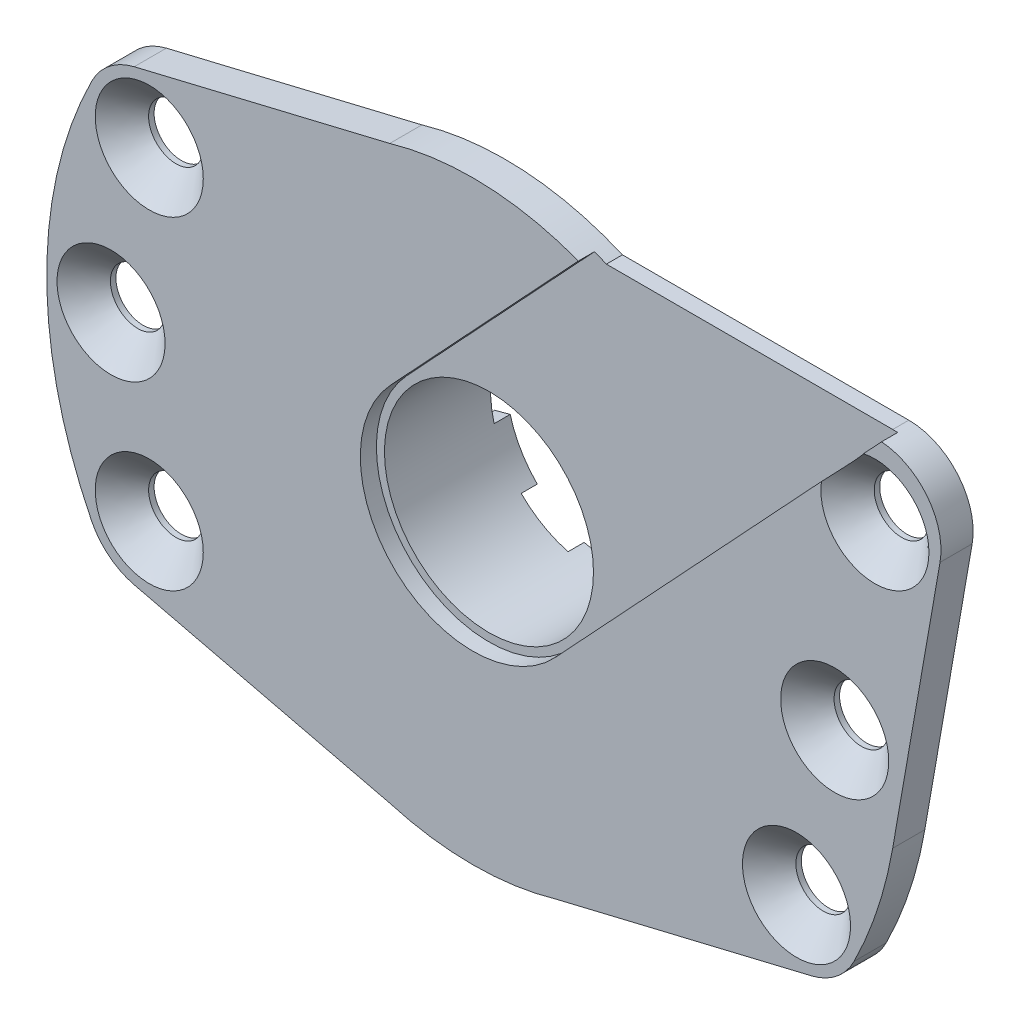
from build123d import *
from build123d.topology import SkipClean

# Parameters (mm, degrees)
SKETCH_1_R                 = 0.5
SKETCH_1_R_2               = 6.5
EXTRUDE_2_DEPTH            = 2
HOLE_WIZARD_M31_AT_2_COUNT = 2
HOLE_WIZARD_M31_AT_2_PITCH = 10.338881425
HOLE_WIZARD_M31_AT_3_COUNT = 2
HOLE_WIZARD_M31_AT_3_PITCH = 20.124611797
HOLE_WIZARD_M31_AT_4_COUNT = 2
HOLE_WIZARD_M31_AT_4_PITCH = 45
HOLE_WIZARD_M31_AT_5_COUNT = 2
HOLE_WIZARD_M31_AT_5_PITCH = 43.796204526
HOLE_WIZARD_M31_AT_6_COUNT = 2
HOLE_WIZARD_M31_AT_6_PITCH = 45.190407637
EXTRUDE_START              = 0.5
SKETCH_4_R                 = 8.5
SKETCH_4_R_2               = 6.5
EXTRUDE_3_DEPTH            = 0.5
EXTRUDE_START_2            = 5.1
SKETCH_5_R                 = 7.5
SKETCH_5_R_2               = 6.5
EXTRUDE_4_DEPTH            = 5.1
CUT_EXTRUDE_1_DEPTH        = 1
EXTRUDE_START_3            = 1
EXTRUDE_5_DEPTH            = 1


with BuildPart() as part:
    # Эскиз1 → Бобышка-Вытянуть2 (new body)
    with BuildSketch(Plane.XY):
        with BuildLine():
            Line((-5.16821295, 17.764543293), (-21.057898637, 13.951904294))
            ThreePointArc((-21.057898637, 13.951904294), (-22.612693727, 13.19430978), (-23.702320561, 11.851160281))
            ThreePointArc((-23.702320561, 11.851160281), (-26.5, 0), (-23.702320561, -11.851160281))
            ThreePointArc((-23.702320561, -11.851160281), (-22.612693727, -13.19430978), (-21.057898637, -13.951904294))
            Line((-21.057898637, -13.951904294), (-5.16821295, -17.764543293))
            ThreePointArc((-5.16821295, -17.764543293), (0, -18.50106547), (5.16821295, -17.764543293))
            Line((5.16821295, -17.764543293), (21.057898637, -13.951904294))
            ThreePointArc((21.057898637, -13.951904294), (22.612693727, -13.19430978), (23.702320561, -11.851160281))
            ThreePointArc((23.702320561, -11.851160281), (25.169556704, -8.291164895), (26.105397143, -4.556121157))
            Line((26.105397143, -4.556121157), (29.049405058, 12.312283599))
            ThreePointArc((29.049405058, 12.312283599), (28.170900607, 15.573823459), (25.108967753, 17))
            Line((25.108967753, 17), (7.299960514, 17))
            ThreePointArc((7.299960514, 17), (1.132350887, 18.466380397), (-5.16821295, 17.764543293))
        make_face()
        with Locations((25, 12.5)):
            Circle(SKETCH_1_R, mode=Mode.SUBTRACT)
        with Locations((22.5, 0)):
            Circle(SKETCH_1_R, mode=Mode.SUBTRACT)
        with Locations((20.124611797, -10.062305899)):
            Circle(SKETCH_1_R, mode=Mode.SUBTRACT)
        with Locations(Location((-20.124611797, -10.062305899, 0), (0, 0, 180))):
            Circle(SKETCH_1_R, mode=Mode.SUBTRACT)
        with Locations(Location((-22.5, 0, 0), (0, 0, 180))):
            Circle(SKETCH_1_R, mode=Mode.SUBTRACT)
        with Locations((-20.124611797, 10.062305899)):
            Circle(SKETCH_1_R, mode=Mode.SUBTRACT)
        Circle(SKETCH_1_R_2, mode=Mode.SUBTRACT)
    extrude(amount=EXTRUDE_2_DEPTH)

    # Эскиз3 → Зенковка для винта с потайной головкой и внутренним шестигранником M31 (revolve, cut)
    with BuildSketch(Plane(origin=(-20.124611797, 10.062305899, 2), x_dir=(0, -1, 0), z_dir=(1, 0, 0))):
        Polygon((0, 0), (0, 2), (1.7, 2), (1.7, 1.66), (3.36, 0), align=None)
    hole_wizard_m31 = revolve(axis=Axis((-20.124611797, 10.062305899, 8.35), (0, 0, -1)), mode=Mode.SUBTRACT)

    # Зенковка для винта с потайной головкой и внутренним шестигранником M31 at 2: Зенковка для винта с потайной головкой и внутренним шестигранником M31 ×2
    with Locations(*[Vector(-0.2297529205473615, -0.9732489894677301, 0) * (i * HOLE_WIZARD_M31_AT_2_PITCH) for i in range(1, HOLE_WIZARD_M31_AT_2_COUNT)]):
        add(hole_wizard_m31, mode=Mode.SUBTRACT)

    # Зенковка для винта с потайной головкой и внутренним шестигранником M31 at 3: Зенковка для винта с потайной головкой и внутренним шестигранником M31 ×2
    with Locations(*[(0, -i * HOLE_WIZARD_M31_AT_3_PITCH, 0) for i in range(1, HOLE_WIZARD_M31_AT_3_COUNT)]):
        add(hole_wizard_m31, mode=Mode.SUBTRACT)

    # Зенковка для винта с потайной головкой и внутренним шестигранником M31 at 4: Зенковка для винта с потайной головкой и внутренним шестигранником M31 ×2
    with Locations(*[Vector(0.894427190999916, -0.4472135954999578, 0) * (i * HOLE_WIZARD_M31_AT_4_PITCH) for i in range(1, HOLE_WIZARD_M31_AT_4_COUNT)]):
        add(hole_wizard_m31, mode=Mode.SUBTRACT)

    # Зенковка для винта с потайной головкой и внутренним шестигранником M31 at 5: Зенковка для винта с потайной головкой и внутренним шестигранником M31 ×2
    with Locations(*[Vector(0.9732489894677302, -0.2297529205473611, 0) * (i * HOLE_WIZARD_M31_AT_5_PITCH) for i in range(1, HOLE_WIZARD_M31_AT_5_COUNT)]):
        add(hole_wizard_m31, mode=Mode.SUBTRACT)

    # Зенковка для винта с потайной головкой и внутренним шестигранником M31 at 6: Зенковка для винта с потайной головкой и внутренним шестигранником M31 ×2
    with Locations(*[Vector(0.9985440308456991, 0.0539427331753181, 0) * (i * HOLE_WIZARD_M31_AT_6_PITCH) for i in range(1, HOLE_WIZARD_M31_AT_6_COUNT)]):
        add(hole_wizard_m31, mode=Mode.SUBTRACT)

    # Эскиз4 → Бобышка-Вытянуть3 (add)
    with SkipClean():  # the faces are left unmerged after this step: merging them gives an invalid solid
        with BuildSketch(Plane(origin=(0, 0, 0), x_dir=(-1, 0, 0), z_dir=(0, 0, -1)).offset(EXTRUDE_START)):
            with Locations(Location((0, 0, 0), (0, 0, 180))):
                Circle(SKETCH_4_R)
            Circle(SKETCH_4_R_2, mode=Mode.SUBTRACT)
        extrude(amount=-EXTRUDE_3_DEPTH)

    # Эскиз5 → Бобышка-Вытянуть4 (add)
    with SkipClean():  # the faces are left unmerged after this step: merging them gives an invalid solid
        with BuildSketch(Plane(origin=(0, 0, -0.5), x_dir=(-1, 0, 0), z_dir=(0, 0, -1)).offset(EXTRUDE_START_2)):
            Circle(SKETCH_5_R)
            Circle(SKETCH_5_R_2, mode=Mode.SUBTRACT)
        extrude(amount=-EXTRUDE_4_DEPTH)

    # Эскиз6 → Вырез-Вытянуть1 (cut)
    with SkipClean():  # the faces are left unmerged after this step: merging them gives an invalid solid
        with BuildSketch(Plane.XY.offset(2)):
            with BuildLine():
                Line((-5.119475911, 4.77398852), (15.340474891, 26.714599569))
                Line((15.340474891, 26.714599569), (25.579426713, 17.166622528))
                Line((25.579426713, 17.166622528), (5.119475911, -4.77398852))
                ThreePointArc((5.119475911, -4.77398852), (-4.77398852, -5.119475911), (-5.119475911, 4.77398852))
            make_face()
        extrude(amount=-CUT_EXTRUDE_1_DEPTH, mode=Mode.SUBTRACT)

    # Эскиз7 → Бобышка-Вытянуть5 (add)
    with SkipClean():  # the faces are left unmerged after this step: merging them gives an invalid solid
        with BuildSketch(Plane(origin=(0, 0, -5.6), x_dir=(-1, 0, 0), z_dir=(0, 0, -1)).offset(EXTRUDE_START_3)):
            with BuildLine():
                Line((-1.941142838, 7.244443697), (-1.682323793, 6.278517871))
                ThreePointArc((-1.682323793, 6.278517871), (0, 6.5), (1.682323793, 6.278517871))
                Line((1.682323793, 6.278517871), (1.941142838, 7.244443697))
                ThreePointArc((1.941142838, 7.244443697), (0, 7.5), (-1.941142838, 7.244443697))
            make_face()
            with BuildLine():
                Line((5.303300859, 5.303300859), (4.596194078, 4.596194078))
                ThreePointArc((4.596194078, 4.596194078), (5.629165125, 3.25), (6.278517871, 1.682323793))
                Line((6.278517871, 1.682323793), (7.244443697, 1.941142838))
                ThreePointArc((7.244443697, 1.941142838), (6.495190528, 3.75), (5.303300859, 5.303300859))
            make_face()
            with BuildLine():
                Line((7.244443697, -1.941142838), (6.278517871, -1.682323793))
                ThreePointArc((6.278517871, -1.682323793), (5.629165125, -3.25), (4.596194078, -4.596194078))
                Line((4.596194078, -4.596194078), (5.303300859, -5.303300859))
                ThreePointArc((5.303300859, -5.303300859), (6.495190528, -3.75), (7.244443697, -1.941142838))
            make_face()
            with BuildLine():
                Line((1.941142838, -7.244443697), (1.682323793, -6.278517871))
                ThreePointArc((1.682323793, -6.278517871), (0, -6.5), (-1.682323793, -6.278517871))
                Line((-1.682323793, -6.278517871), (-1.941142838, -7.244443697))
                ThreePointArc((-1.941142838, -7.244443697), (0, -7.5), (1.941142838, -7.244443697))
            make_face()
            with BuildLine():
                Line((-5.303300859, -5.303300859), (-4.596194078, -4.596194078))
                ThreePointArc((-4.596194078, -4.596194078), (-5.629165125, -3.25), (-6.278517871, -1.682323793))
                Line((-6.278517871, -1.682323793), (-7.244443697, -1.941142838))
                ThreePointArc((-7.244443697, -1.941142838), (-6.495190528, -3.75), (-5.303300859, -5.303300859))
            make_face()
            with BuildLine():
                Line((-7.244443697, 1.941142838), (-6.278517871, 1.682323793))
                ThreePointArc((-6.278517871, 1.682323793), (-5.629165125, 3.25), (-4.596194078, 4.596194078))
                Line((-4.596194078, 4.596194078), (-5.303300859, 5.303300859))
                ThreePointArc((-5.303300859, 5.303300859), (-6.495190528, 3.75), (-7.244443697, 1.941142838))
            make_face()
        extrude(amount=-EXTRUDE_5_DEPTH)


solid = part.part
